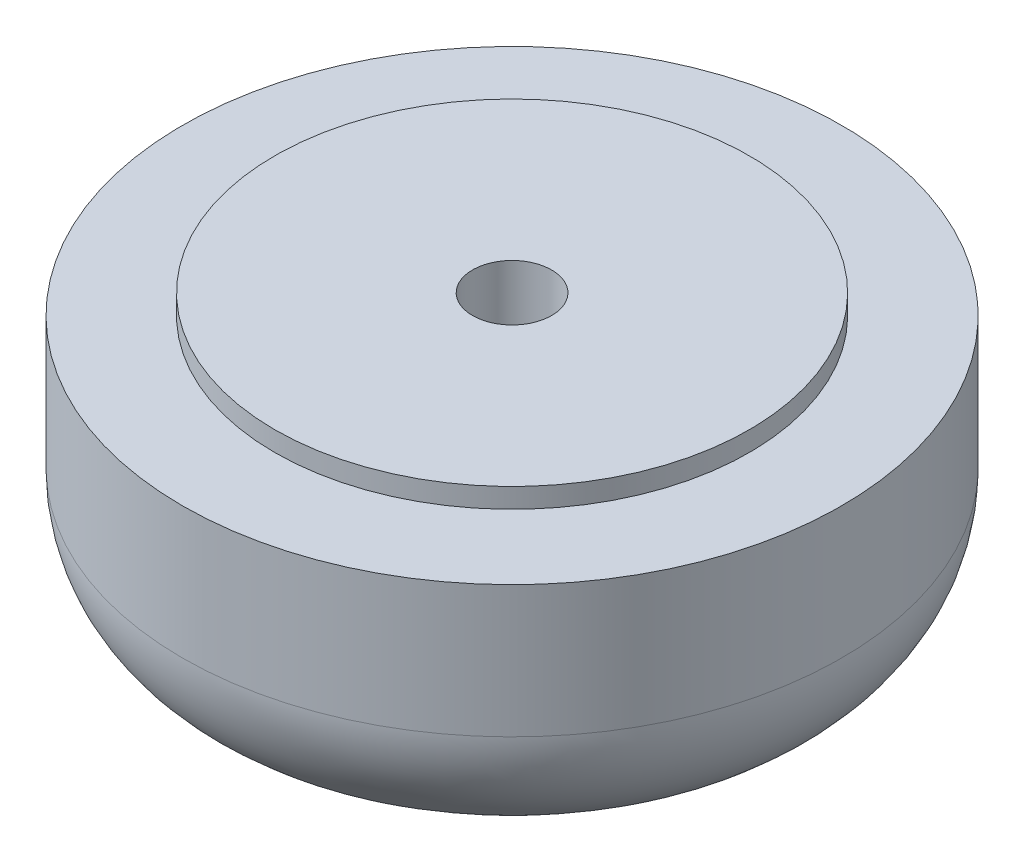
from build123d import *

# Parameters (mm, degrees)
SKETCH_1_R          = 5
EXTRUDE_1_DEPTH     = 4
SKETCH_2_R          = 3.6
EXTRUDE_2_DEPTH     = 0.3
FILLET_1_R          = 2
SKETCH_3_R          = 0.6
CUT_EXTRUDE_1_DEPTH = 9.275868534


with BuildPart() as part:
    # 草图1 → 凸台-拉伸1 (new body)
    with BuildSketch(Plane(origin=(0, 0, 0), x_dir=(1, 0, 0), z_dir=(0, 1, 0))):
        with Locations(Location((0, 0, 0), (0, 0, 270))):
            Circle(SKETCH_1_R)
    extrude(amount=EXTRUDE_1_DEPTH)

    # 草图2 → 凸台-拉伸2 (add)
    with BuildSketch(Plane(origin=(0, 4, 0), x_dir=(1, 0, 0), z_dir=(0, 1, 0))):
        with Locations(Location((0, 0, 0), (0, 0, 270))):
            Circle(SKETCH_2_R)
    extrude(amount=EXTRUDE_2_DEPTH)

    # 圆角1
    fillet_1_edges = [part.edges().sort_by_distance(p)[0] for p in [
        (0, 0, -5),
    ]]
    fillet(fillet_1_edges, radius=FILLET_1_R)

    # 草图3 → 切除-拉伸1 (cut, through all)
    with BuildSketch(Plane(origin=(0, 4.3, 0), x_dir=(1, 0, 0), z_dir=(0, 1, 0))):
        with Locations(Location((0, 0, 0), (0, 0, 270))):
            Circle(SKETCH_3_R)
    extrude(amount=-CUT_EXTRUDE_1_DEPTH, mode=Mode.SUBTRACT)


solid = part.part
